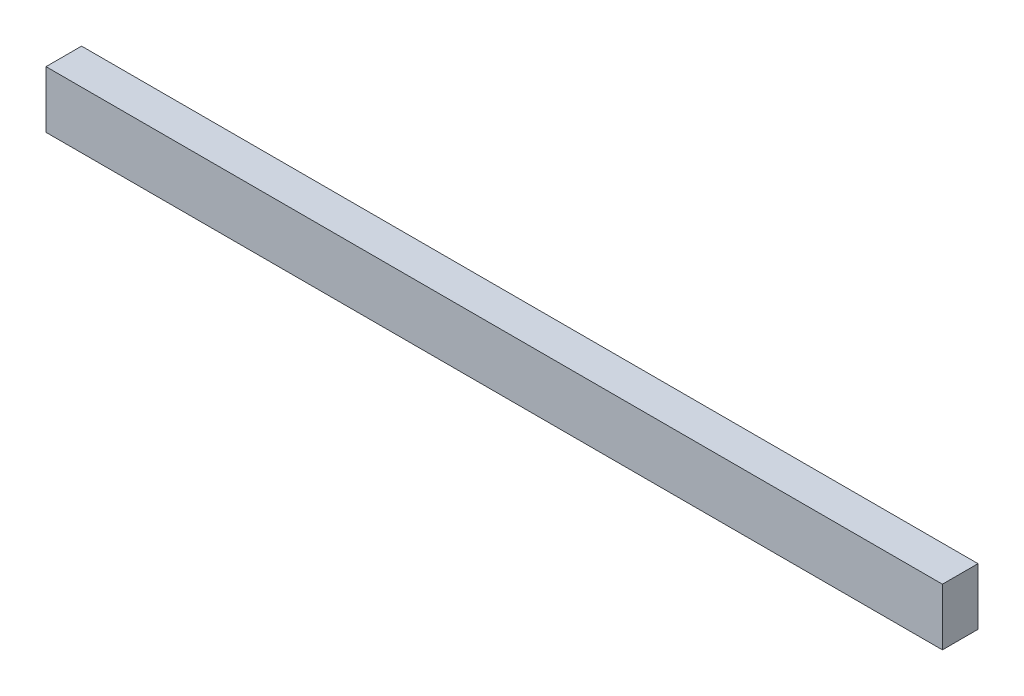
from build123d import *

# Parameters (mm, degrees)
STORE_KABLO_KANALI_YATAY_40X25_1_START = -727
SKETCH1_W                              = 630
SKETCH1_H                              = 40
STORE_KABLO_KANALI_YATAY_40X25_1_DEPTH = 25


with BuildPart() as part:
    # Sketch1 → STORE_kablo_kanali_yatay_40x25_1 (new body)
    with BuildSketch(Plane.XY.offset(STORE_KABLO_KANALI_YATAY_40X25_1_START)):
        with Locations((1015, 1640)):
            Rectangle(SKETCH1_W, SKETCH1_H)
    extrude(amount=-STORE_KABLO_KANALI_YATAY_40X25_1_DEPTH)


solid = part.part
